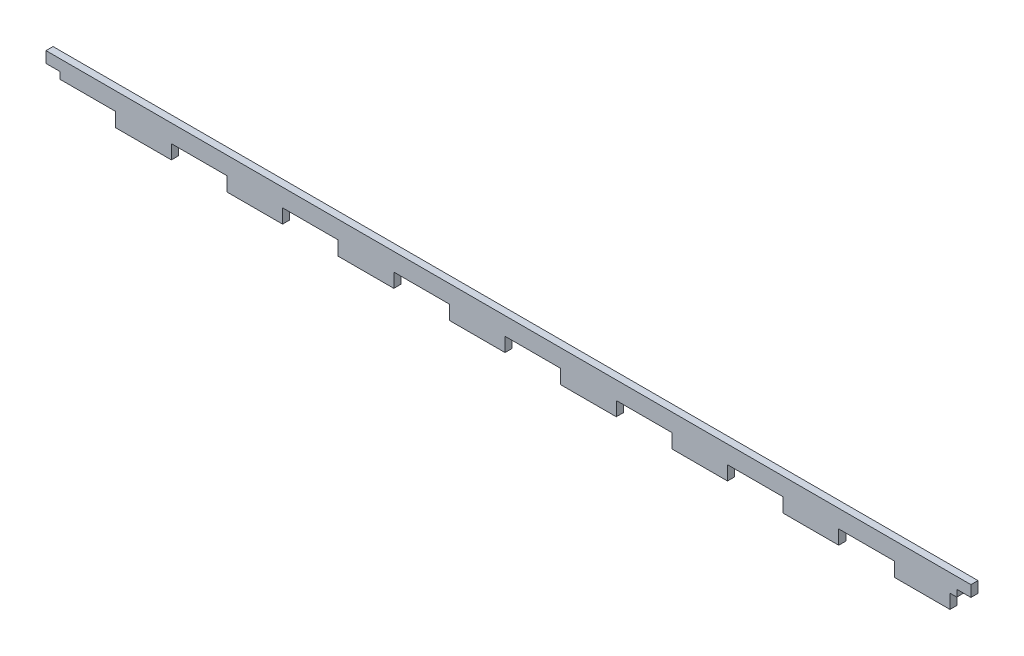
from build123d import *

# Parameters (mm, degrees)
BOSS_EXTRUDE1_DEPTH = 3.175


with BuildPart() as part:
    # Sketch1 → Boss-Extrude1 (new body)
    with BuildSketch(Plane.XY):
        Polygon((0, 0), (6.35, 0), (6.35, -3.03), (31.35, -3.03), (31.35, -9.38), (56.35, -9.38), (56.35, -3.03), (81.35, -3.03), (81.35, -9.38), (106.35, -9.38), (106.35, -3.03), (131.35, -3.03), (131.35, -9.38), (156.35, -9.38), (156.35, -3.03), (181.35, -3.03), (181.35, -9.38), (206.35, -9.38), (206.35, -3.03), (231.35, -3.03), (231.35, -9.38), (256.35, -9.38), (256.35, -3.03), (281.35, -3.03), (281.35, -9.38), (306.35, -9.38), (306.35, -3.03), (331.35, -3.03), (331.35, -9.38), (356.35, -9.38), (356.35, -3.03), (381.35, -3.03), (381.35, -9.38), (406.35, -9.38), (406.35, -3.03), (409.425, -3.028710343), (409.425, 2.97e-07), (415.775, 2.97e-07), (415.775, 5), (409.42, 5), (0, 5), align=None)
    extrude(amount=BOSS_EXTRUDE1_DEPTH)


solid = part.part
